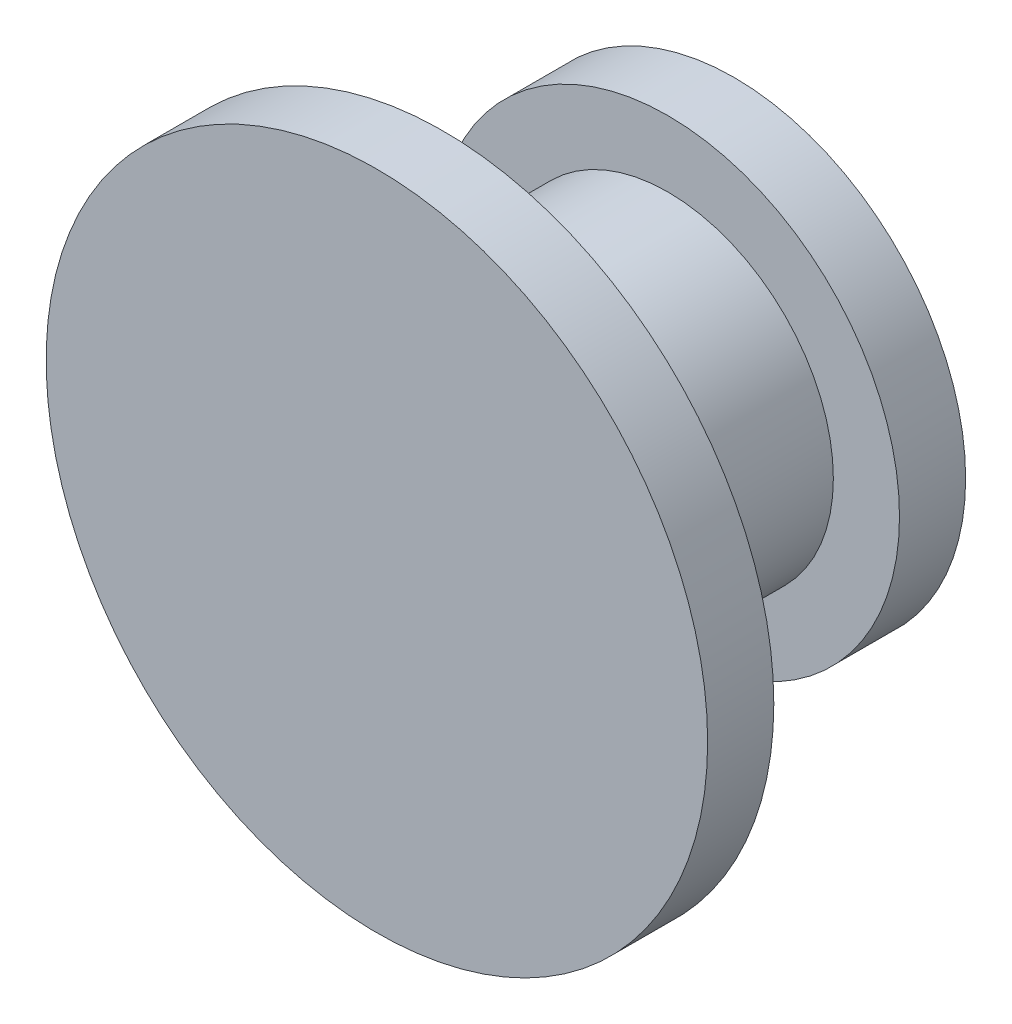
from build123d import *

# Parameters (mm, degrees)
SKIZZE1_R                       = 2.5
AUFSATZ_LINEAR_AUSTRAGEN1_DEPTH = 3.4
SKIZZE2_R                       = 3.5
AUFSATZ_LINEAR_AUSTRAGEN2_DEPTH = 1
SKIZZE3_R                       = 5
AUFSATZ_LINEAR_AUSTRAGEN3_DEPTH = 1


with BuildPart() as part:
    # Skizze1 → Aufsatz-Linear austragen1 (new body)
    with BuildSketch(Plane.XY):
        Circle(SKIZZE1_R)
    extrude(amount=-AUFSATZ_LINEAR_AUSTRAGEN1_DEPTH)

    # Skizze2 → Aufsatz-Linear austragen2 (add)
    with BuildSketch(Plane(origin=(0, 0, -3.4), x_dir=(-1, 0, 0), z_dir=(0, 0, -1))):
        Circle(SKIZZE2_R)
    extrude(amount=AUFSATZ_LINEAR_AUSTRAGEN2_DEPTH)

    # Skizze3 → Aufsatz-Linear austragen3 (add)
    with BuildSketch(Plane.XY):
        Circle(SKIZZE3_R)
    extrude(amount=AUFSATZ_LINEAR_AUSTRAGEN3_DEPTH)


solid = part.part
